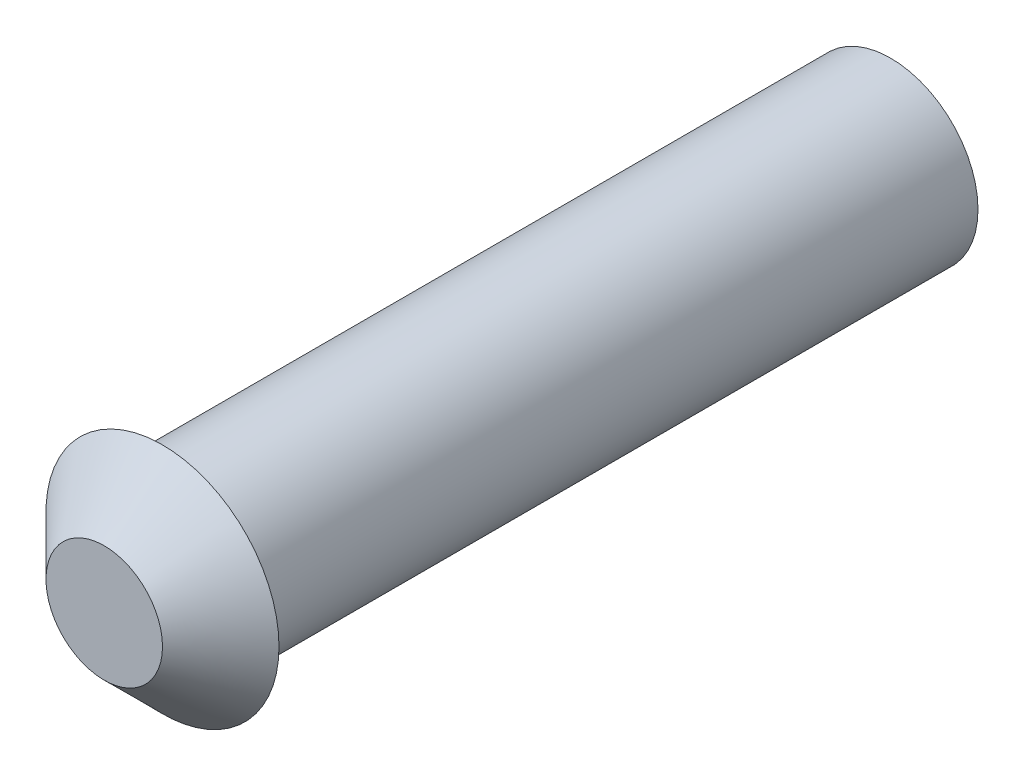
from build123d import *

# Parameters (mm, degrees)
SKETCH1_R           = 1.905
BOSS_EXTRUDE1_DEPTH = 7.9375
SKETCH2_R           = 2.54
SKETCH3_R           = 1.27


with BuildPart() as part:
    # Sketch1 → Boss-Extrude1 (new, symmetric)
    with BuildSketch(Plane.XY):
        Circle(SKETCH1_R)
    extrude(amount=BOSS_EXTRUDE1_DEPTH, both=True)

    # Sketch2 → Loft2 section 0
    with BuildSketch(Plane.XY.offset(7.9375)):
        Circle(SKETCH2_R)
    # Sketch3 → Loft2 section 1
    with BuildSketch(Plane.XY.offset(9.2075)):
        Circle(SKETCH3_R)
    loft()


solid = part.part
